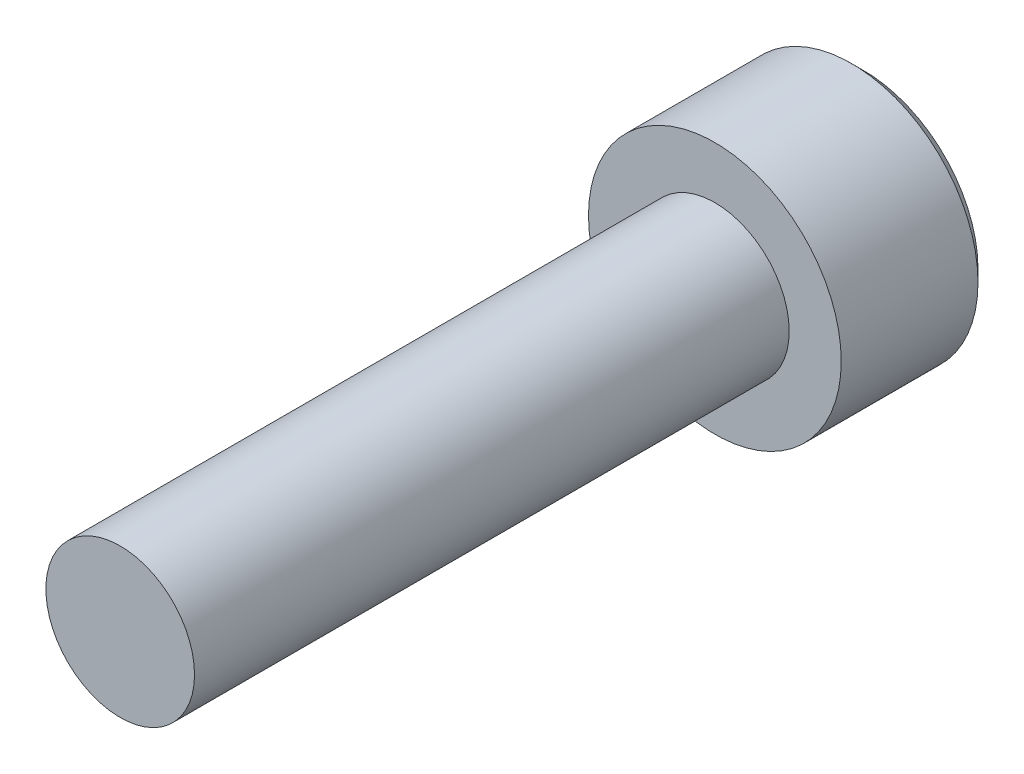
from build123d import *

# Parameters (mm, degrees)
SK_SHANK_R        = 2.5
EXT_SHANK_DEPTH   = 25
SK_HEAD_R         = 4.25
EXT_HEAD_DEPTH    = 5
CUT_HEX_DEPTH     = 3
CHAMFER_HEAD_SIZE = 0.4


with BuildPart() as part:
    # Sk_shank → Ext_shank (new body)
    with BuildSketch(Plane.XY):
        Circle(SK_SHANK_R)
    extrude(amount=EXT_SHANK_DEPTH)

    # Sk_head → Ext_head (add)
    with BuildSketch(Plane.XY):
        Circle(SK_HEAD_R)
    extrude(amount=EXT_HEAD_DEPTH)

    # Sk_hex → Cut_hex (cut)
    with BuildSketch(Plane.XY):
        Polygon((2.309401077, 0), (1.154700538, 2), (-1.154700538, 2), (-2.309401077, 0), (-1.154700538, -2), (1.154700538, -2), align=None)
    extrude(amount=CUT_HEX_DEPTH, mode=Mode.SUBTRACT)

    # Chamfer_head
    chamfer_head_edges = [part.edges().sort_by_distance(p)[0] for p in [
        (1.732050808, -1, 0),
        (1.732050808, 1, 0),
        (0, 2, 0),
        (-1.732050808, 1, 0),
        (-1.732050808, -1, 0),
        (0, -2, 0),
        (-4.25, 0, 0),
    ]]
    chamfer(chamfer_head_edges, length=CHAMFER_HEAD_SIZE)


solid = part.part
